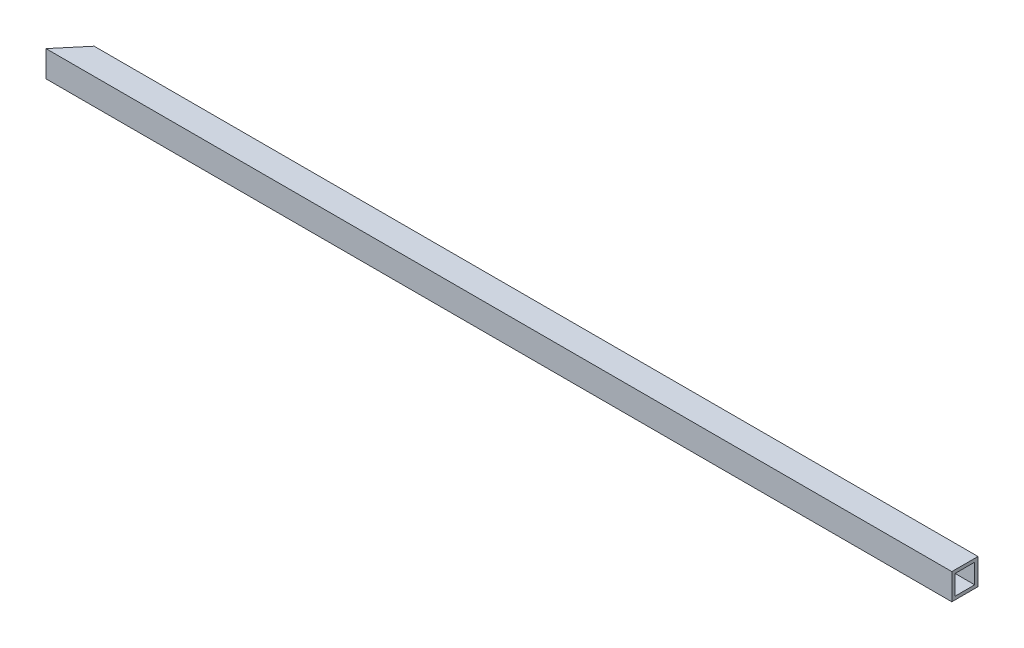
from build123d import *

# Parameters (mm, degrees)
BOSS_EXTRUDE1_DEPTH      = 254
BOSS_EXTRUDE1_DEPTH_BACK = 185.42
SKETCH1_W                = 12.7
SKETCH1_H                = 12.7
SKETCH1_W_2              = 9.525
SKETCH1_H_2              = 9.525
CUT_EXTRUDE1_DEPTH       = 255.158700422
CUT_EXTRUDE1_DEPTH_BACK  = 255.158700422


with BuildPart() as part:
    # Sketch1 → Boss-Extrude1 (new, two sides: drawn at the far end of the back side and taken through both)
    with BuildSketch(Plane(origin=(0, 0, 0), x_dir=(0, 0, -1), z_dir=(1, 0, 0)).offset(-BOSS_EXTRUDE1_DEPTH_BACK)):
        Rectangle(SKETCH1_W, SKETCH1_H)
        Rectangle(SKETCH1_W_2, SKETCH1_H_2, mode=Mode.SUBTRACT)
    extrude(amount=BOSS_EXTRUDE1_DEPTH + BOSS_EXTRUDE1_DEPTH_BACK)

    # Sketch2 → Cut-Extrude1 (cut, two sides: drawn at the far end of the back side and taken through both)
    with BuildSketch(Plane(origin=(0, 0, 0), x_dir=(1, 0, 0), z_dir=(0, 1, 0)).offset(-CUT_EXTRUDE1_DEPTH_BACK)):
        Polygon((-185.42, -6.35), (-174.250456919, 6.961343094), (-183.078216502, 14.368712905), (-194.247759583, 1.057369811), align=None)
    extrude(amount=CUT_EXTRUDE1_DEPTH + CUT_EXTRUDE1_DEPTH_BACK, mode=Mode.SUBTRACT)


solid = part.part
